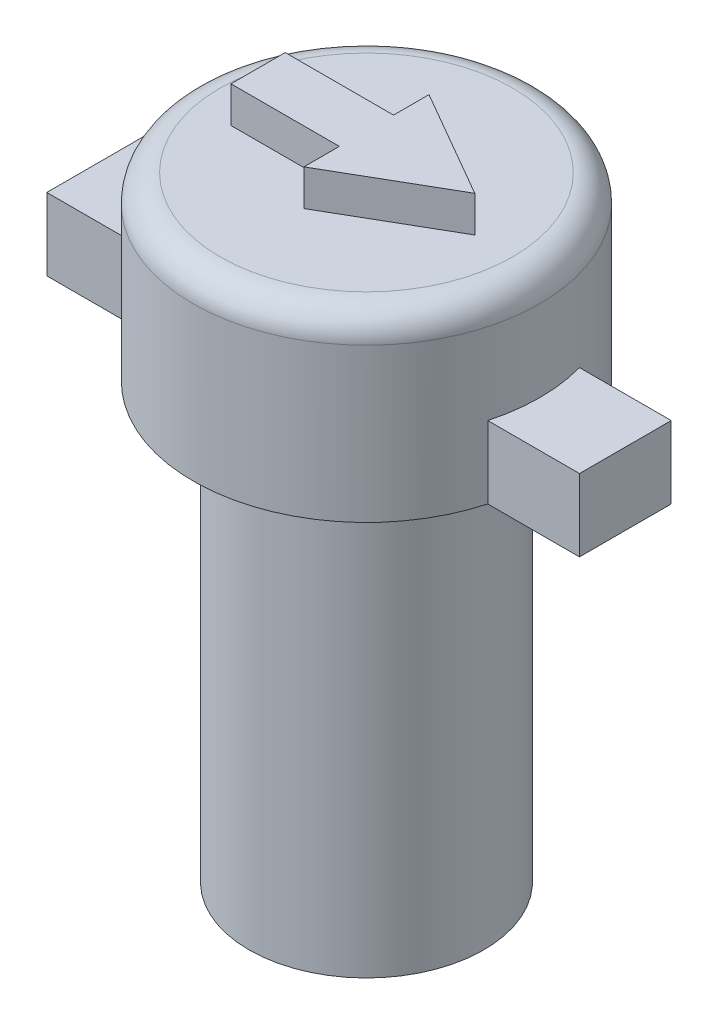
from build123d import *

# Parameters (mm, degrees)
SKETCH1_R           = 3.25
BOSS_EXTRUDE1_DEPTH = 12.018
SKETCH6_R           = 4.8
BOSS_EXTRUDE2_DEPTH = 5
FILLET1_R           = 0.75
BOSS_EXTRUDE3_DEPTH = 1
BOSS_EXTRUDE4_DEPTH = 2


with BuildPart() as part:
    # Sketch1 → Boss-Extrude1 (new body)
    with BuildSketch(Plane(origin=(0, 0, 0), x_dir=(1, 0, 0), z_dir=(0, 1, 0))):
        with Locations(Location((0, 0, 0), (0, 0, 270))):
            Circle(SKETCH1_R)
    extrude(amount=BOSS_EXTRUDE1_DEPTH)

    # Sketch6 → Boss-Extrude2 (add)
    with BuildSketch(Plane(origin=(0, 12.018, 0), x_dir=(1, 0, 0), z_dir=(0, 1, 0))):
        with Locations(Location((0, 0, 0), (0, 0, 270))):
            Circle(SKETCH6_R)
    extrude(amount=BOSS_EXTRUDE2_DEPTH)

    # Fillet1
    fillet1_edges = [part.edges().sort_by_distance(p)[0] for p in [
        (0, 17.018, -4.8),
    ]]
    fillet(fillet1_edges, radius=FILLET1_R)

    # Sketch8 → Boss-Extrude3 (add)
    with BuildSketch(Plane(origin=(0, 17.018, 0), x_dir=(1, 0, 0), z_dir=(0, 1, 0))):
        Polygon((0, 0.75), (-3, 0.75), (-3, -0.75), (0, -0.75), (0, -1.732050808), (3, 0), (0, 1.732050808), align=None)
    extrude(amount=BOSS_EXTRUDE3_DEPTH)

    # Sketch9 → Boss-Extrude4 (add)
    with BuildSketch(Plane.XZ.offset(-12.018)):
        with BuildLine():
            Line((-4.405788806, 1.905), (-6.945788806, 1.905))
            Line((-6.945788806, 1.905), (-6.945788806, -1.905))
            Line((-6.945788806, -1.905), (-4.405788806, -1.905))
            ThreePointArc((-4.405788806, -1.905), (-4.8, 0), (-4.405788806, 1.905))
        make_face()
        with BuildLine():
            Line((4.628941564, 1.27), (7.168941564, 1.27))
            Line((7.168941564, 1.27), (7.168941564, -1.27))
            Line((7.168941564, -1.27), (4.628941564, -1.27))
            ThreePointArc((4.628941564, -1.27), (4.8, 0), (4.628941564, 1.27))
        make_face()
    extrude(amount=-BOSS_EXTRUDE4_DEPTH)


solid = part.part
